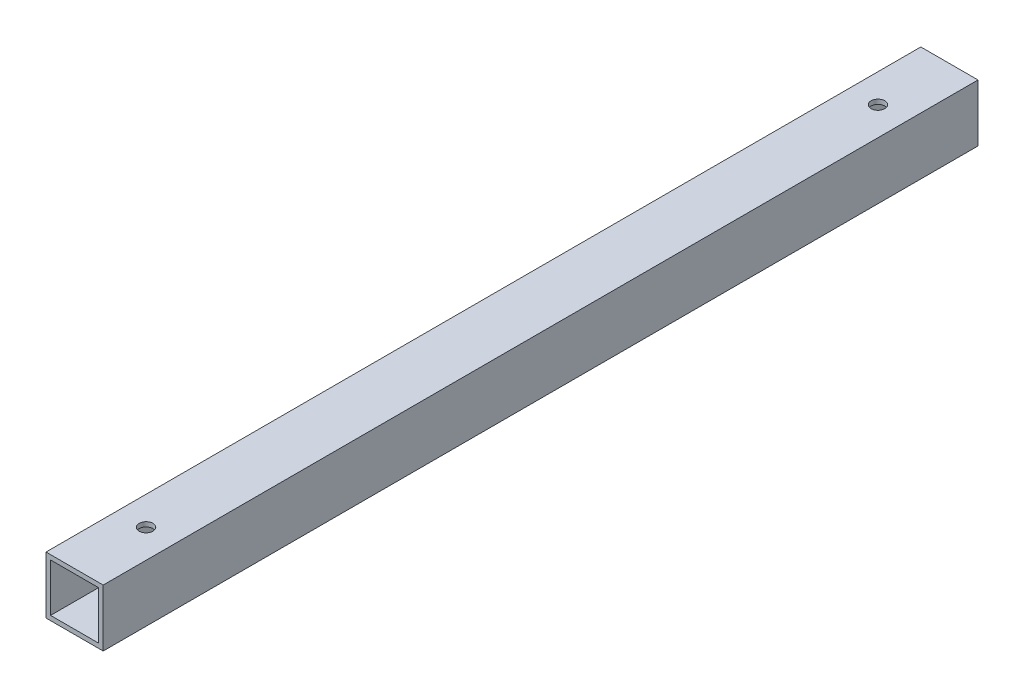
from build123d import *

# Parameters (mm, degrees)
SKETCH_1_W          = 50
SKETCH_1_H          = 50
SKETCH_1_W_2        = 42
SKETCH_1_H_2        = 42
EXTRUDE_1_DEPTH     = 382.5
SKETCH_2_R          = 6
CUT_EXTRUDE_1_DEPTH = 387.563384195


with BuildPart() as part:
    # 草图1 → 凸台-拉伸1 (new, symmetric)
    with BuildSketch(Plane.XY):
        Rectangle(SKETCH_1_W, SKETCH_1_H)
        Rectangle(SKETCH_1_W_2, SKETCH_1_H_2, mode=Mode.SUBTRACT)
    extrude(amount=EXTRUDE_1_DEPTH, both=True)

    # 草图2 → 切除-拉伸1 (cut, through all)
    with BuildSketch(Plane(origin=(0, 25, 0), x_dir=(1, 0, 0), z_dir=(0, 1, 0))):
        with Locations(Location((0, 320, 0), (0, 0, 270))):
            Circle(SKETCH_2_R)
        with Locations(Location((0, -320, 0), (0, 0, 270))):
            Circle(SKETCH_2_R)
    extrude(amount=-CUT_EXTRUDE_1_DEPTH, mode=Mode.SUBTRACT)


solid = part.part
